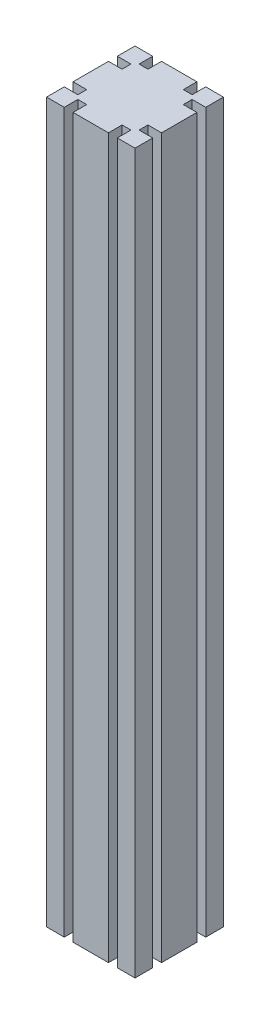
from build123d import *

# Parameters (mm, degrees)
BOSS_EXTRUDE1_DEPTH = 650


with BuildPart() as part:
    # Sketch1 → Boss-Extrude1 (new body)
    with BuildSketch(Plane(origin=(0, 0, 0), x_dir=(1, 0, 0), z_dir=(0, 1, 0))):
        Polygon((-7.320779393, 34.479989845), (-7.320779393, 50.479989845), (8.679220607, 50.479989845), (8.679220607, 38.179989845), (16.679220607, 38.179989845), (16.679220607, 50.479989845), (48.679220607, 50.479989845), (48.679220607, 38.179989845), (56.679220607, 38.179989845), (56.679220607, 50.479989845), (72.679220607, 50.479989845), (72.679220607, 34.479989845), (60.379220607, 34.479989845), (60.379220607, 26.479989845), (72.679220607, 26.479989845), (72.679220607, -5.520010155), (60.379220607, -5.520010155), (60.379220607, -13.520010155), (72.679220607, -13.520010155), (72.679220607, -29.520010155), (56.679220607, -29.520010155), (56.679220607, -17.220010155), (48.679220607, -17.220010155), (48.679220607, -29.520010155), (16.679220607, -29.520010155), (16.679220607, -17.220010155), (8.679220607, -17.220010155), (8.679220607, -29.520010155), (-7.320779393, -29.520010155), (-7.320779393, -13.520010155), (4.979220607, -13.520010155), (4.979220607, -5.520010155), (-7.320779393, -5.520010155), (-7.320779393, 26.479989845), (4.979220607, 26.479989845), (4.979220607, 34.479989845), align=None)
    extrude(amount=BOSS_EXTRUDE1_DEPTH)


solid = part.part
